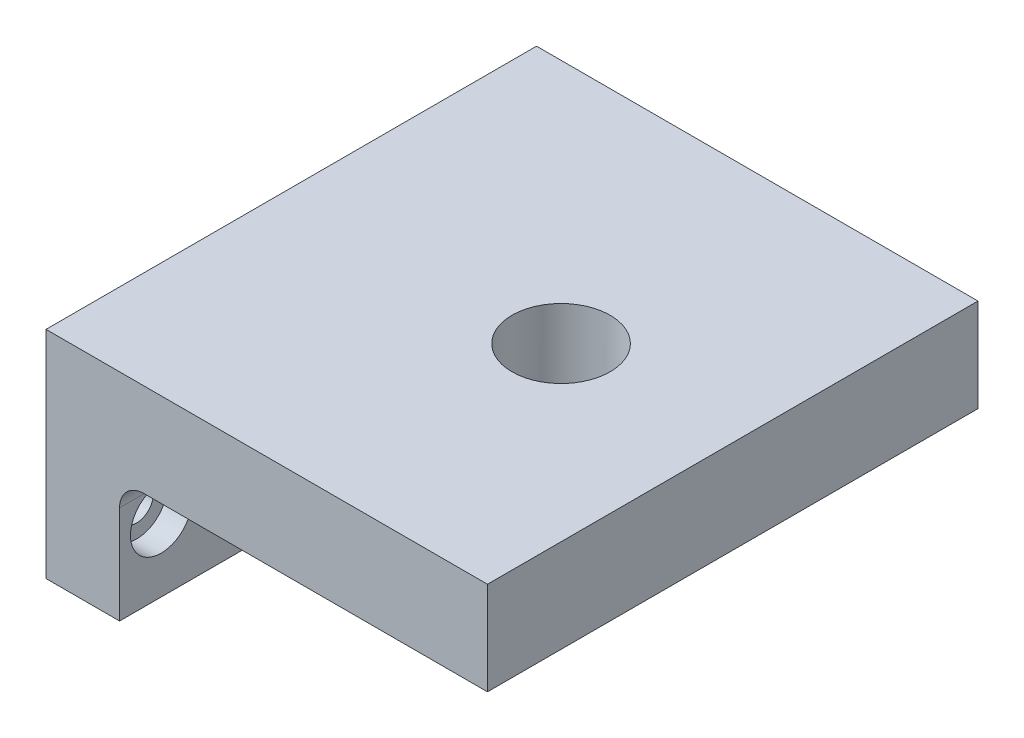
from build123d import *

# Parameters (mm, degrees)
BOSS_EXTRUDE1_DEPTH = 50.8
SKETCH2_R           = 1.7399
CUT_EXTRUDE1_DEPTH  = 45.72
FILLET1_R           = 2.54
SKETCH11_R          = 3.175
CUT_EXTRUDE5_DEPTH  = 2.54
SKETCH12_R          = 5.08
CUT_EXTRUDE6_DEPTH  = 72.906677743


with BuildPart() as part:
    # Sketch1 → Boss-Extrude1 (new body)
    with BuildSketch(Plane.XY):
        Polygon((0, 0), (0, -22.352), (7.62, -22.352), (7.62, -9.652), (45.72, -9.652), (45.72, 0), align=None)
    extrude(amount=BOSS_EXTRUDE1_DEPTH)

    # Sketch2 → Cut-Extrude1 (cut)
    with BuildSketch(Plane.ZY):
        with Locations((4.3, -15.24)):
            Circle(SKETCH2_R)
        with Locations((46.5, -15.24)):
            Circle(SKETCH2_R)
    extrude(amount=-CUT_EXTRUDE1_DEPTH, mode=Mode.SUBTRACT)

    # Fillet1
    fillet1_edges = [part.edges().sort_by_distance(p)[0] for p in [
        (7.62, -9.652, 25.4),
    ]]
    fillet(fillet1_edges, radius=FILLET1_R)

    # Sketch11 → Cut-Extrude5 (cut)
    with BuildSketch(Plane(origin=(7.62, 0, 0), x_dir=(0, 0, -1), z_dir=(1, 0, 0))):
        with Locations((-46.5, -15.24)):
            Circle(SKETCH11_R)
        with Locations((-4.3, -15.24)):
            Circle(SKETCH11_R)
    extrude(amount=-CUT_EXTRUDE5_DEPTH, mode=Mode.SUBTRACT)

    # Sketch12 → Cut-Extrude6 (cut, through all)
    with BuildSketch(Plane(origin=(0, 0, 0), x_dir=(1, 0, 0), z_dir=(0, 1, 0))):
        with Locations((27.94, -25.4)):
            Circle(SKETCH12_R)
    extrude(amount=-CUT_EXTRUDE6_DEPTH, mode=Mode.SUBTRACT)


solid = part.part
